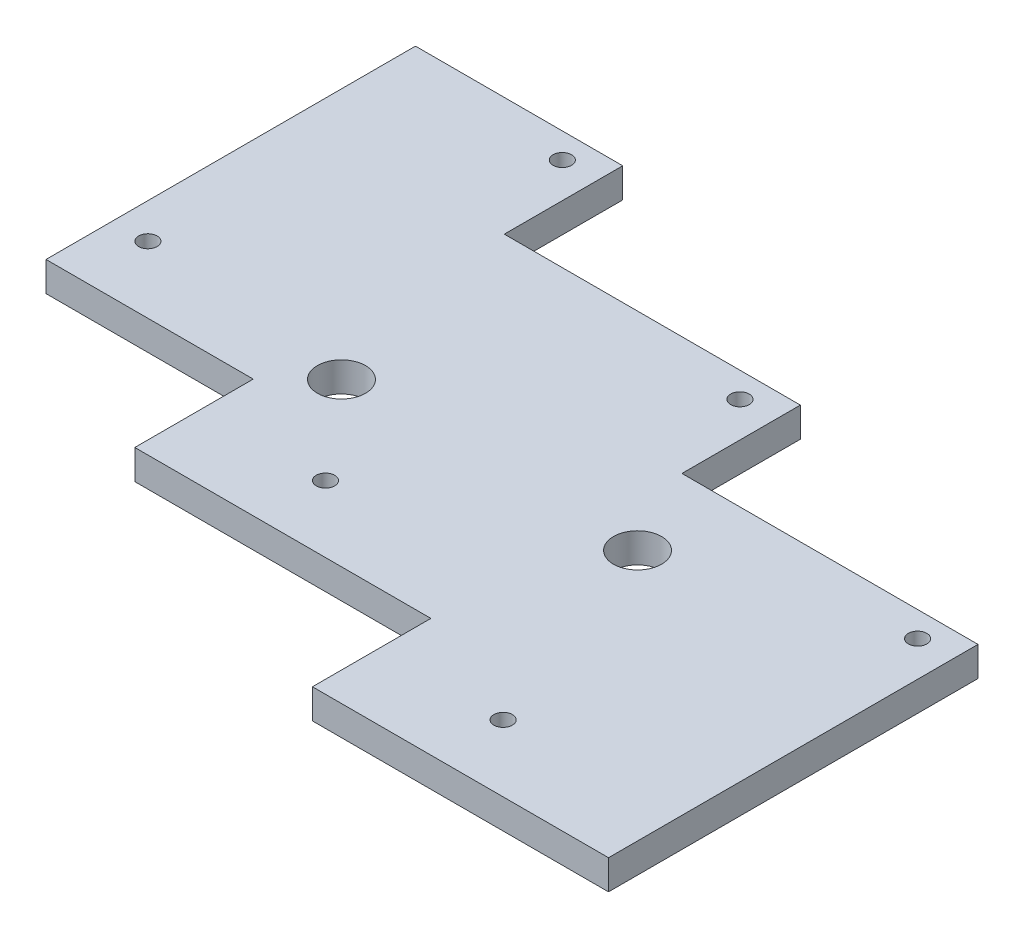
from build123d import *

# Parameters (mm, degrees)
BOSS_EXTRUDE1_DEPTH        = 3.175
CUT_EXTRUDE2_START         = 3.175
SKETCH2_R                  = 5.1562
CUT_EXTRUDE2_DEPTH         = 111.817820597
F_10_24_TAPPED_HOLE1_D     = 3.9624
F_10_24_TAPPED_HOLE1_DEPTH = 6.35
F_10_24_TAPPED_HOLE1_TIP   = 1.190425058


with BuildPart() as part:
    # Sketch1 → Boss-Extrude1 (new, symmetric)
    with BuildSketch(Plane(origin=(0, 0, 0), x_dir=(1, 0, 0), z_dir=(0, 1, 0))):
        Polygon((-85.725, -14.224), (-41.275, -14.224), (-41.275, -39.624), (22.225, -39.624), (22.225, -65.024), (85.725, -65.024), (85.725, 14.224), (22.225, 14.224), (22.225, 39.624), (-41.275, 39.624), (-41.275, 65.024), (-85.725, 65.024), align=None)
    extrude(amount=BOSS_EXTRUDE1_DEPTH, both=True)

    # Sketch2 → Cut-Extrude2 (cut, through all)
    with BuildSketch(Plane(origin=(0, 0, 0), x_dir=(1, 0, 0), z_dir=(0, 1, 0)).offset(CUT_EXTRUDE2_START)):
        with Locations(Location((-31.75, -4.826, 0), (0, 0, 270))):
            Circle(SKETCH2_R)
        with Locations(Location((31.75, -4.826, 0), (0, 0, 270))):
            Circle(SKETCH2_R)
    extrude(amount=-CUT_EXTRUDE2_DEPTH, mode=Mode.SUBTRACT)

    # #10-24 Tapped Hole1
    with Locations(Plane(origin=(0, 3.175, 0), x_dir=(1, 0, 0), z_dir=(0, 1, 0))):
        with Locations((-78.1812, 0.0762), (-48.8188, 59.6138), (-14.6812, -25.3238), (14.6812, 34.2138), (48.8188, -50.7238), (78.1812, 8.8138)):
            Hole(F_10_24_TAPPED_HOLE1_D / 2, depth=F_10_24_TAPPED_HOLE1_DEPTH)
            with Locations((0, 0, -(F_10_24_TAPPED_HOLE1_DEPTH + F_10_24_TAPPED_HOLE1_TIP / 2))):  # 118° drill point
                Cone(0, F_10_24_TAPPED_HOLE1_D / 2, F_10_24_TAPPED_HOLE1_TIP, mode=Mode.SUBTRACT)


solid = part.part
